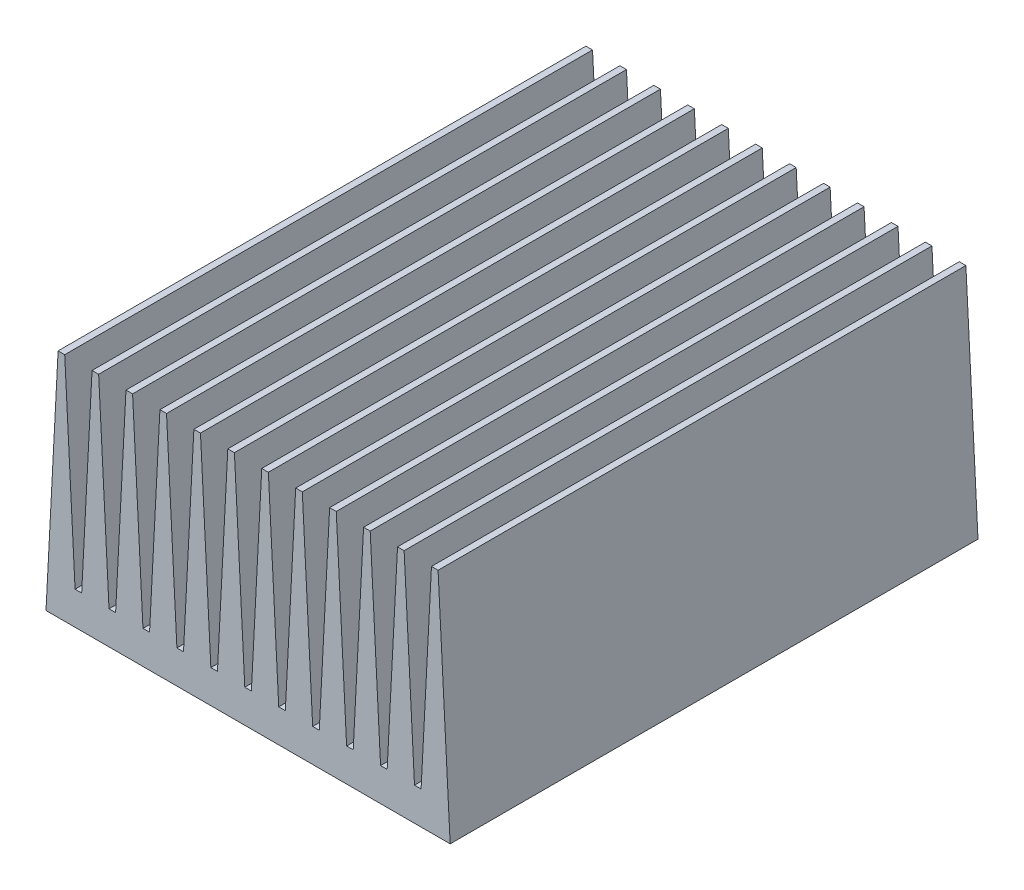
from build123d import *

# Parameters (mm, degrees)
BOSS_EXTRUDE1_DEPTH = 80


with BuildPart() as part:
    # Sketch1 → Boss-Extrude1 (new body)
    with BuildSketch(Plane.XY):
        Polygon((0, 5), (0.5, 5), (2.072233378, 35), (3.072233378, 35), (4.644466757, 5), (5.144466757, 5), (5.644466757, 5), (7.216700135, 35), (8.216700135, 35), (9.788933514, 5), (10.288933514, 5), (10.788933514, 5), (12.361166892, 35), (13.361166892, 35), (14.933400271, 5), (15.433400271, 5), (15.933400271, 5), (17.505633649, 35), (18.505633649, 35), (20.077867028, 5), (20.577867028, 5), (21.077867028, 5), (22.650100406, 35), (23.650100406, 35), (25.222333785, 5), (25.722333785, 5), (26.222333785, 5), (27.794567163, 35), (28.794567163, 35), (30.628839438, 0), (0, 0), align=None)
    boss_extrude1 = extrude(amount=-BOSS_EXTRUDE1_DEPTH)

    # Mirror1: Boss-Extrude1 across plane
    add(boss_extrude1.mirror(Plane(origin=(0, 0, 0), x_dir=(0, 0, 1), z_dir=(1, 0, 0))))


solid = part.part
